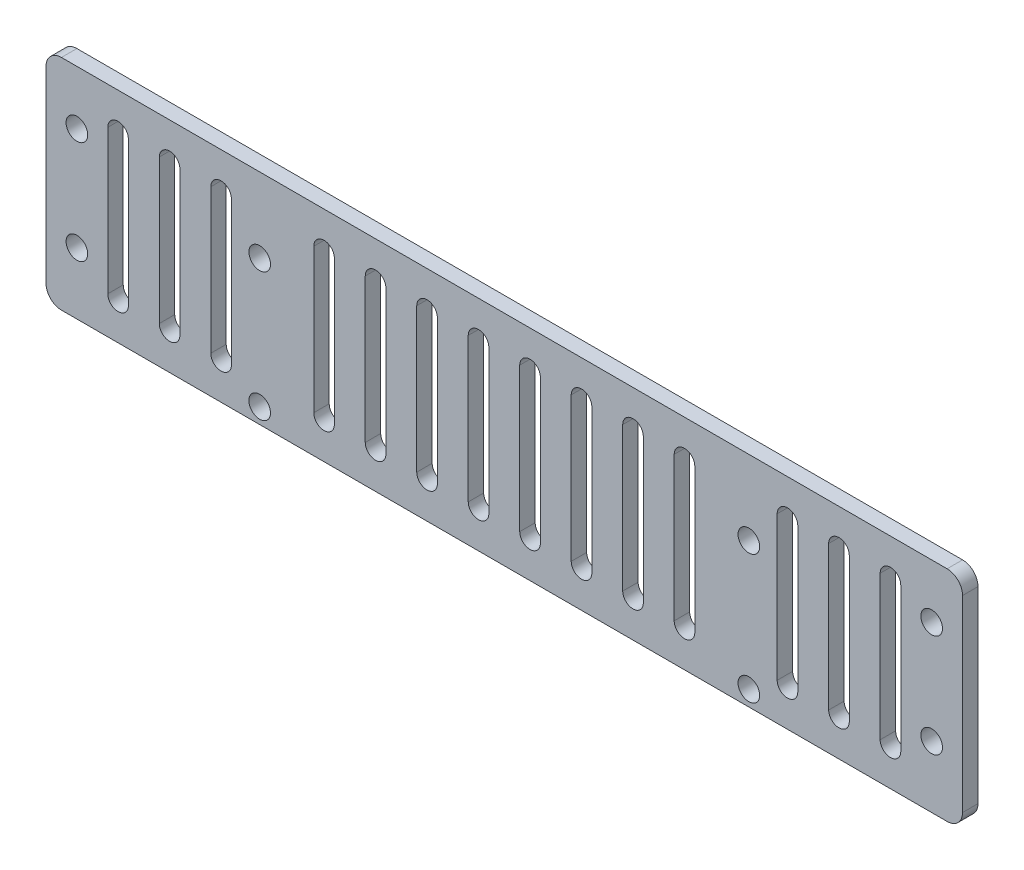
from build123d import *

# Parameters (mm, degrees)
SKETCH_1_W          = 178
SKETCH_1_H          = 42.5
SKETCH_1_R          = 2.1
EXTRUDE_1_DEPTH     = 3
FILLET_1_R          = 3
CUT_EXTRUDE_1_DEPTH = 10


with BuildPart() as part:
    # 草图1 → 凸台-拉伸1 (new body)
    with BuildSketch(Plane.XY):
        with Locations((0, 5.001204258)):
            Rectangle(SKETCH_1_W, SKETCH_1_H)
        with Locations((-83, 15.751204258)):
            Circle(SKETCH_1_R, mode=Mode.SUBTRACT)
        with Locations((-83, -4.248795742)):
            Circle(SKETCH_1_R, mode=Mode.SUBTRACT)
        with Locations((-47.5, 11.751204258)):
            Circle(SKETCH_1_R, mode=Mode.SUBTRACT)
        with Locations((47.5, 11.751204258)):
            Circle(SKETCH_1_R, mode=Mode.SUBTRACT)
        with Locations((47.5, -13.248795742)):
            Circle(SKETCH_1_R, mode=Mode.SUBTRACT)
        with Locations((-47.5, -13.248795742)):
            Circle(SKETCH_1_R, mode=Mode.SUBTRACT)
        with Locations(Location((83, -4.248795742, 0), (0, 0, 180))):
            Circle(SKETCH_1_R, mode=Mode.SUBTRACT)
        with Locations(Location((83, 15.751204258, 0), (0, 0, 180))):
            Circle(SKETCH_1_R, mode=Mode.SUBTRACT)
    extrude(amount=EXTRUDE_1_DEPTH)

    # 圆角1
    fillet_1_edges = [part.edges().sort_by_distance(p)[0] for p in [
        (-89, 26.251204258, 1.5),
        (89, 26.251204258, 1.5),
        (89, -16.248795742, 1.5),
        (-89, -16.248795742, 1.5),
    ]]
    fillet(fillet_1_edges, radius=FILLET_1_R)

    # 草图2 → 切除-拉伸1 (cut)
    with BuildSketch(Plane.XY.offset(3)):
        with BuildLine():
            Line((-73, 19.001204258), (-73, -8.998795742))
            ThreePointArc((-73, -8.998795742), (-75, -10.998795742), (-77, -8.998795742))
            Line((-77, -8.998795742), (-77, 19.001204258))
            ThreePointArc((-77, 19.001204258), (-75, 21.001204258), (-73, 19.001204258))
        make_face()
        with BuildLine():
            Line((-67, 19.001204258), (-67, -8.998795742))
            ThreePointArc((-67, -8.998795742), (-65, -10.998795742), (-63, -8.998795742))
            Line((-63, -8.998795742), (-63, 19.001204258))
            ThreePointArc((-63, 19.001204258), (-65, 21.001204258), (-67, 19.001204258))
        make_face()
        with BuildLine():
            Line((-57, 19.001204258), (-57, -8.998795742))
            ThreePointArc((-57, -8.998795742), (-55, -10.998795742), (-53, -8.998795742))
            Line((-53, -8.998795742), (-53, 19.001204258))
            ThreePointArc((-53, 19.001204258), (-55, 21.001204258), (-57, 19.001204258))
        make_face()
        with BuildLine():
            Line((-37, 19.001204258), (-37, -8.998795742))
            ThreePointArc((-37, -8.998795742), (-35, -10.998795742), (-33, -8.998795742))
            Line((-33, -8.998795742), (-33, 19.001204258))
            ThreePointArc((-33, 19.001204258), (-35, 21.001204258), (-37, 19.001204258))
        make_face()
        with BuildLine():
            Line((-27, 19.001204258), (-27, -8.998795742))
            ThreePointArc((-27, -8.998795742), (-25, -10.998795742), (-23, -8.998795742))
            Line((-23, -8.998795742), (-23, 19.001204258))
            ThreePointArc((-23, 19.001204258), (-25, 21.001204258), (-27, 19.001204258))
        make_face()
        with BuildLine():
            Line((-17, 19.001204258), (-17, -8.998795742))
            ThreePointArc((-17, -8.998795742), (-15, -10.998795742), (-13, -8.998795742))
            Line((-13, -8.998795742), (-13, 19.001204258))
            ThreePointArc((-13, 19.001204258), (-15, 21.001204258), (-17, 19.001204258))
        make_face()
        with BuildLine():
            Line((-7, 19.001204258), (-7, -8.998795742))
            ThreePointArc((-7, -8.998795742), (-5, -10.998795742), (-3, -8.998795742))
            Line((-3, -8.998795742), (-3, 19.001204258))
            ThreePointArc((-3, 19.001204258), (-5, 21.001204258), (-7, 19.001204258))
        make_face()
        with BuildLine():
            Line((3, 19.001204258), (3, -8.998795742))
            ThreePointArc((3, -8.998795742), (5, -10.998795742), (7, -8.998795742))
            Line((7, -8.998795742), (7, 19.001204258))
            ThreePointArc((7, 19.001204258), (5, 21.001204258), (3, 19.001204258))
        make_face()
        with BuildLine():
            Line((13, 19.001204258), (13, -8.998795742))
            ThreePointArc((13, -8.998795742), (15, -10.998795742), (17, -8.998795742))
            Line((17, -8.998795742), (17, 19.001204258))
            ThreePointArc((17, 19.001204258), (15, 21.001204258), (13, 19.001204258))
        make_face()
        with BuildLine():
            Line((23, 19.001204258), (23, -8.998795742))
            ThreePointArc((23, -8.998795742), (25, -10.998795742), (27, -8.998795742))
            Line((27, -8.998795742), (27, 19.001204258))
            ThreePointArc((27, 19.001204258), (25, 21.001204258), (23, 19.001204258))
        make_face()
        with BuildLine():
            Line((33, 19.001204258), (33, -8.998795742))
            ThreePointArc((33, -8.998795742), (35, -10.998795742), (37, -8.998795742))
            Line((37, -8.998795742), (37, 19.001204258))
            ThreePointArc((37, 19.001204258), (35, 21.001204258), (33, 19.001204258))
        make_face()
        with BuildLine():
            Line((53, 19.001204258), (53, -8.998795742))
            ThreePointArc((53, -8.998795742), (55, -10.998795742), (57, -8.998795742))
            Line((57, -8.998795742), (57, 19.001204258))
            ThreePointArc((57, 19.001204258), (55, 21.001204258), (53, 19.001204258))
        make_face()
        with BuildLine():
            Line((63, 19.001204258), (63, -8.998795742))
            ThreePointArc((63, -8.998795742), (65, -10.998795742), (67, -8.998795742))
            Line((67, -8.998795742), (67, 19.001204258))
            ThreePointArc((67, 19.001204258), (65, 21.001204258), (63, 19.001204258))
        make_face()
        with BuildLine():
            Line((73, 19.001204258), (73, -8.998795742))
            ThreePointArc((73, -8.998795742), (75, -10.998795742), (77, -8.998795742))
            Line((77, -8.998795742), (77, 19.001204258))
            ThreePointArc((77, 19.001204258), (75, 21.001204258), (73, 19.001204258))
        make_face()
    extrude(amount=-CUT_EXTRUDE_1_DEPTH, mode=Mode.SUBTRACT)


solid = part.part
